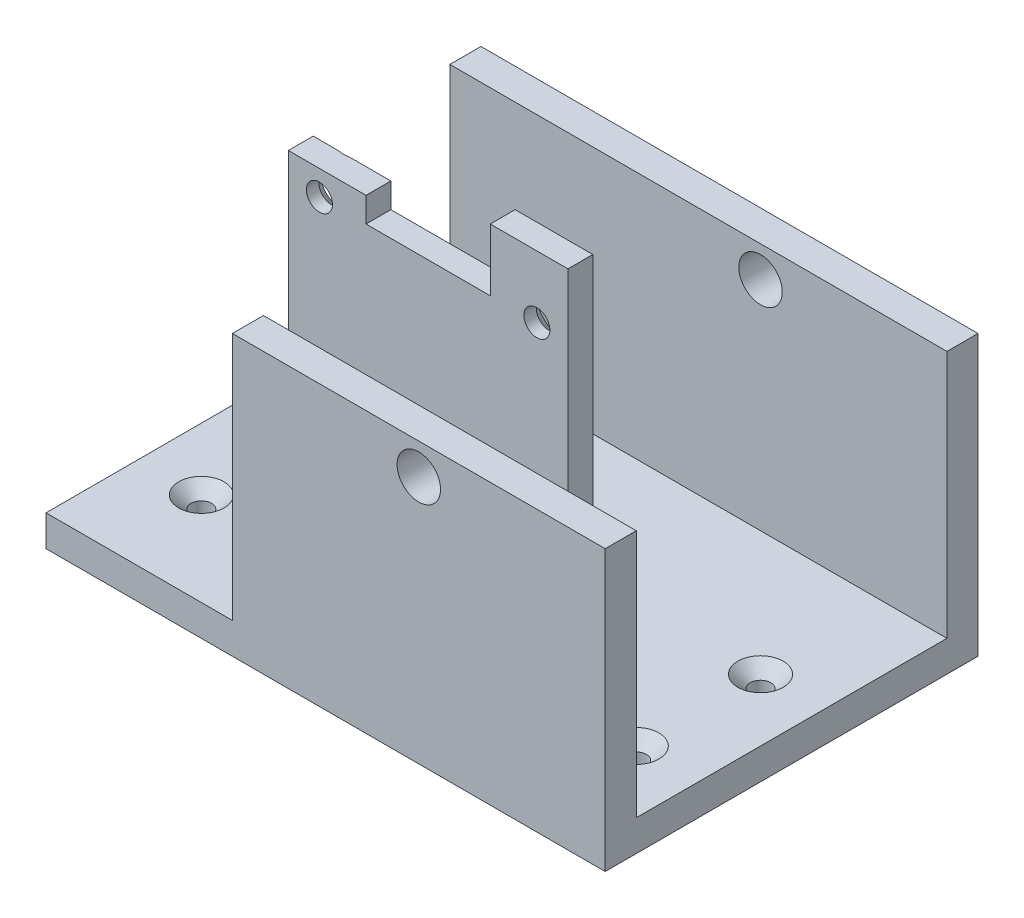
from build123d import *

# Parameters (mm, degrees)
SKIZZE1_W                       = 90
SKIZZE1_H                       = 60
AUFSATZ_LINEAR_AUSTRAGEN1_DEPTH = 5
SKIZZE2_W                       = 90
SKIZZE2_H                       = 5
AUFSATZ_LINEAR_AUSTRAGEN2_DEPTH = 40
SKIZZE3_W                       = 45
SKIZZE3_H                       = 4
AUFSATZ_LINEAR_AUSTRAGEN3_DEPTH = 37
SKIZZE4_R                       = 2.1
SKIZZE4_W                       = 20
SKIZZE4_H                       = 10
SCHNITT_LINEAR_AUSTRAGEN1_DEPTH = 5
FASE1_SIZE                      = 2
FASE2_SIZE                      = 2
SKIZZE6_R                       = 3.5
SCHNITT_LINEAR_AUSTRAGEN2_DEPTH = 5
SCHNITT_LINEAR_START            = -5
SKIZZE8_R                       = 3.5
SCHNITT_LINEAR_AUSTRAGEN3_DEPTH = 5
SKIZZE9_R                       = 1.65
SCHNITT_LINEAR_AUSTRAGEN4_DEPTH = 5
FASE3_SIZE                      = 2
SKIZZE10_W                      = 30
SKIZZE10_H                      = 40
SCHNITT_LINEAR_AUSTRAGEN5_DEPTH = 10
SKIZZE11_W                      = 12.5
SKIZZE11_H                      = 5.996169329
SCHNITT_LINEAR_AUSTRAGEN6_DEPTH = 10
SKIZZE12_W                      = 10
SKIZZE12_H                      = 40
SCHNITT_LINEAR_AUSTRAGEN7_DEPTH = 10


with BuildPart() as part:
    # Skizze1 → Aufsatz-Linear austragen1 (new body)
    with BuildSketch(Plane(origin=(0, 0, 0), x_dir=(1, 0, 0), z_dir=(0, 1, 0))):
        Rectangle(SKIZZE1_W, SKIZZE1_H)
    extrude(amount=AUFSATZ_LINEAR_AUSTRAGEN1_DEPTH)

    # Skizze2 → Aufsatz-Linear austragen2 (add)
    with BuildSketch(Plane(origin=(0, 5, 0), x_dir=(1, 0, 0), z_dir=(0, 1, 0))):
        with Locations((0, 27.5)):
            Rectangle(SKIZZE2_W, SKIZZE2_H)
        with Locations((0, -27.5)):
            Rectangle(SKIZZE2_W, SKIZZE2_H)
    extrude(amount=AUFSATZ_LINEAR_AUSTRAGEN2_DEPTH)

    # Skizze3 → Aufsatz-Linear austragen3 (add)
    with BuildSketch(Plane(origin=(0, 5, 0), x_dir=(1, 0, 0), z_dir=(0, 1, 0))):
        with Locations((-22.5, 11.004200432)):
            Rectangle(SKIZZE3_W, SKIZZE3_H)
    extrude(amount=AUFSATZ_LINEAR_AUSTRAGEN3_DEPTH)

    # Skizze4 → Schnitt-Linear austragen1 (cut)
    with BuildSketch(Plane.XY.offset(-9.004200432)):
        with Locations((-40, 32)):
            Circle(SKIZZE4_R)
        with Locations((-5, 32)):
            Circle(SKIZZE4_R)
        with Locations((-22.5, 37)):
            Rectangle(SKIZZE4_W, SKIZZE4_H)
    extrude(amount=-SCHNITT_LINEAR_AUSTRAGEN1_DEPTH, mode=Mode.SUBTRACT)

    # Fase1
    fase1_edges = [part.edges().sort_by_distance(p)[0] for p in [
        (-42.1, 32, -13.004200432),
    ]]
    chamfer(fase1_edges, length=FASE1_SIZE)

    # Fase2
    fase2_edges = [part.edges().sort_by_distance(p)[0] for p in [
        (-7.1, 32, -13.004200432),
    ]]
    chamfer(fase2_edges, length=FASE2_SIZE)

    # Skizze6 → Schnitt-Linear austragen2 (cut)
    with BuildSketch(Plane(origin=(0, 0, -30), x_dir=(-1, 0, 0), z_dir=(0, 0, -1))):
        with Locations((-15, 40)):
            Circle(SKIZZE6_R)
    extrude(amount=-SCHNITT_LINEAR_AUSTRAGEN2_DEPTH, mode=Mode.SUBTRACT)

    # Skizze8 → Schnitt-Linear austragen3 (cut)
    with BuildSketch(Plane.XY.offset(30).offset(SCHNITT_LINEAR_START)):
        with Locations(Location((15, 40, 0), (0, 0, 180))):
            Circle(SKIZZE8_R)
    extrude(amount=SCHNITT_LINEAR_AUSTRAGEN3_DEPTH, mode=Mode.SUBTRACT)

    # Skizze9 → Schnitt-Linear austragen4 (cut)
    with BuildSketch(Plane(origin=(0, 5, 0), x_dir=(1, 0, 0), z_dir=(0, 1, 0))):
        with Locations(Location((35, 5, 0), (0, 0, 270))):
            Circle(SKIZZE9_R)
        with Locations(Location((35, -15, 0), (0, 0, 270))):
            Circle(SKIZZE9_R)
        with Locations(Location((-35, -15, 0), (0, 0, 270))):
            Circle(SKIZZE9_R)
        with Locations(Location((-35, 5, 0), (0, 0, 270))):
            Circle(SKIZZE9_R)
    extrude(amount=-SCHNITT_LINEAR_AUSTRAGEN4_DEPTH, mode=Mode.SUBTRACT)

    # Fase3
    fase3_edges = [part.edges().sort_by_distance(p)[0] for p in [
        (-35, 5, -6.65),
        (-35, 5, 13.35),
        (35, 5, 13.35),
        (35, 5, -6.65),
    ]]
    chamfer(fase3_edges, length=FASE3_SIZE)

    # Skizze10 → Schnitt-Linear austragen5 (cut)
    with BuildSketch(Plane.XY.offset(30)):
        with Locations((-30, 25)):
            Rectangle(SKIZZE10_W, SKIZZE10_H)
    extrude(amount=-SCHNITT_LINEAR_AUSTRAGEN5_DEPTH, mode=Mode.SUBTRACT)

    # Skizze11 → Schnitt-Linear austragen6 (cut)
    with BuildSketch(Plane.XY.offset(-9.004200432)):
        with Locations((-38.75, 39.001915336)):
            Rectangle(SKIZZE11_W, SKIZZE11_H)
    extrude(amount=-SCHNITT_LINEAR_AUSTRAGEN6_DEPTH, mode=Mode.SUBTRACT)

    # Skizze12 → Schnitt-Linear austragen7 (cut)
    with BuildSketch(Plane(origin=(0, 0, -30), x_dir=(-1, 0, 0), z_dir=(0, 0, -1))):
        with Locations((40, 25)):
            Rectangle(SKIZZE12_W, SKIZZE12_H)
    extrude(amount=-SCHNITT_LINEAR_AUSTRAGEN7_DEPTH, mode=Mode.SUBTRACT)


solid = part.part
